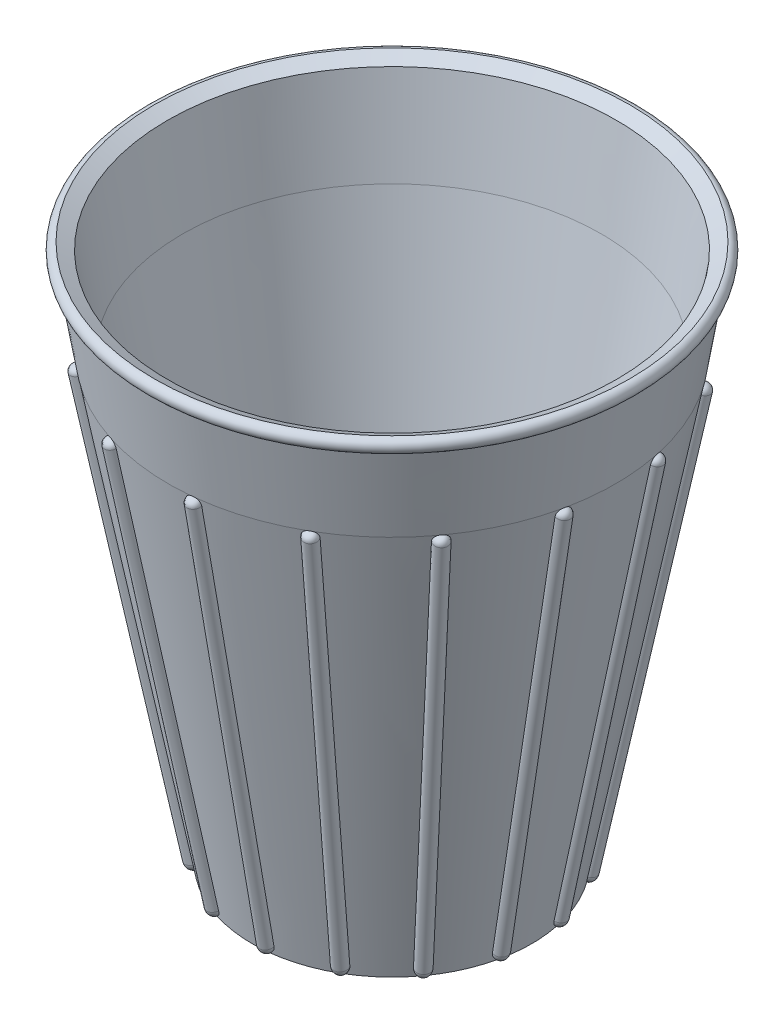
from build123d import *

# Parameters (mm, degrees)
CIRPATTERN1_COUNT = 15


with BuildPart() as part:
    # Sketch1 → Revolve1 (revolve)
    with BuildSketch(Plane.XY):
        with BuildLine():
            Line((-32.130708731, -1), (-34, 0))
            ThreePointArc((-34, 0), (-35, -1), (-34, -2))
            Line((-34, -2), (-32, -14))
            Line((-32, -14), (-20, -77))
            Line((-20, -77), (-12.6, -77))
            Line((-12.6, -77), (-12.6, -75.97))
            Line((-12.6, -75.97), (0, -75.97))
            Line((0, -75.97), (0, -74))
            Line((0, -74), (-18.535470636, -74))
            Line((-18.535470636, -74), (-29.964042064, -14))
            Line((-29.964042064, -14), (-32.130708731, -1))
        make_face()
    revolve(axis=Axis((0, 0, 0), (0, -1, 0)))

    # Sketch2 → Revolve7 (revolve)
    with BuildSketch(Plane.XY):
        with BuildLine():
            Line((-32, -14), (-20, -77))
            ThreePointArc((-20, -77), (-20.784277354, -76.717582079), (-21.208455158, -76))
            Line((-21.208455158, -76), (-32.827502777, -15))
            ThreePointArc((-32.827502777, -15), (-32.648991688, -14.305337999), (-32, -14))
        make_face()
    revolve7 = revolve(axis=Axis((-32.971330552, -8.900514604, 0), (0.18711210788999555, -0.9823385664224746, 0)))

    # CirPattern1: Revolve7 ×15 about axis
    cirpattern1_axis = Axis((0, -14, 0), (0, 1, 0))
    for i in range(1, CIRPATTERN1_COUNT):
        add(revolve7.rotate(cirpattern1_axis, i * 360 / CIRPATTERN1_COUNT))


solid = part.part
